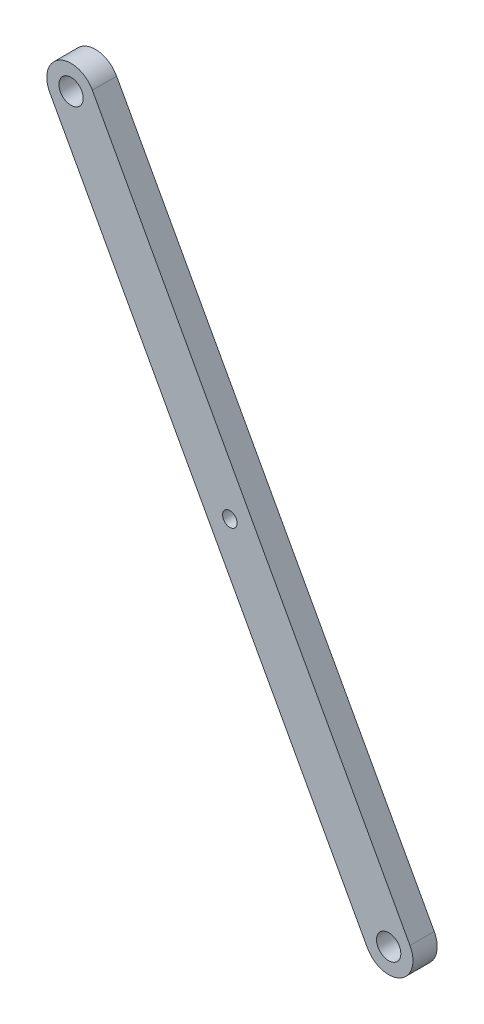
from build123d import *

# Parameters (mm, degrees)
ESQUISSE1_R             = 2.5
BOSS_EXTRU_1_DEPTH      = 5
ESQUISSE2_R             = 1.5
ENL_V_MAT_EXTRU_1_DEPTH = 216.249621368


with BuildPart() as part:
    # Esquisse1 → Boss.-Extru.1 (new body)
    with BuildSketch(Plane.XY):
        with BuildLine():
            Line((101.909269915, -7.287605066), (167.331697147, -127.150397953))
            ThreePointArc((167.331697147, -127.150397953), (165.338343201, -133.934684212), (158.554056942, -131.941330266))
            Line((158.554056942, -131.941330266), (93.13162971, -12.078537379))
            ThreePointArc((93.13162971, -12.078537379), (95.124983656, -5.29425112), (101.909269915, -7.287605066))
        make_face()
        with Locations((97.520449813, -9.683071223)):
            Circle(ESQUISSE1_R, mode=Mode.SUBTRACT)
        with Locations((162.942877045, -129.545864109)):
            Circle(ESQUISSE1_R, mode=Mode.SUBTRACT)
    extrude(amount=BOSS_EXTRU_1_DEPTH)

    # Esquisse2 → Enlèv. mat.-Extru.1 (cut, through all)
    with BuildSketch(Plane.XY.offset(5)):
        with Locations((130.231663429, -69.614467666)):
            Circle(ESQUISSE2_R)
    extrude(amount=-ENL_V_MAT_EXTRU_1_DEPTH, mode=Mode.SUBTRACT)


solid = part.part
